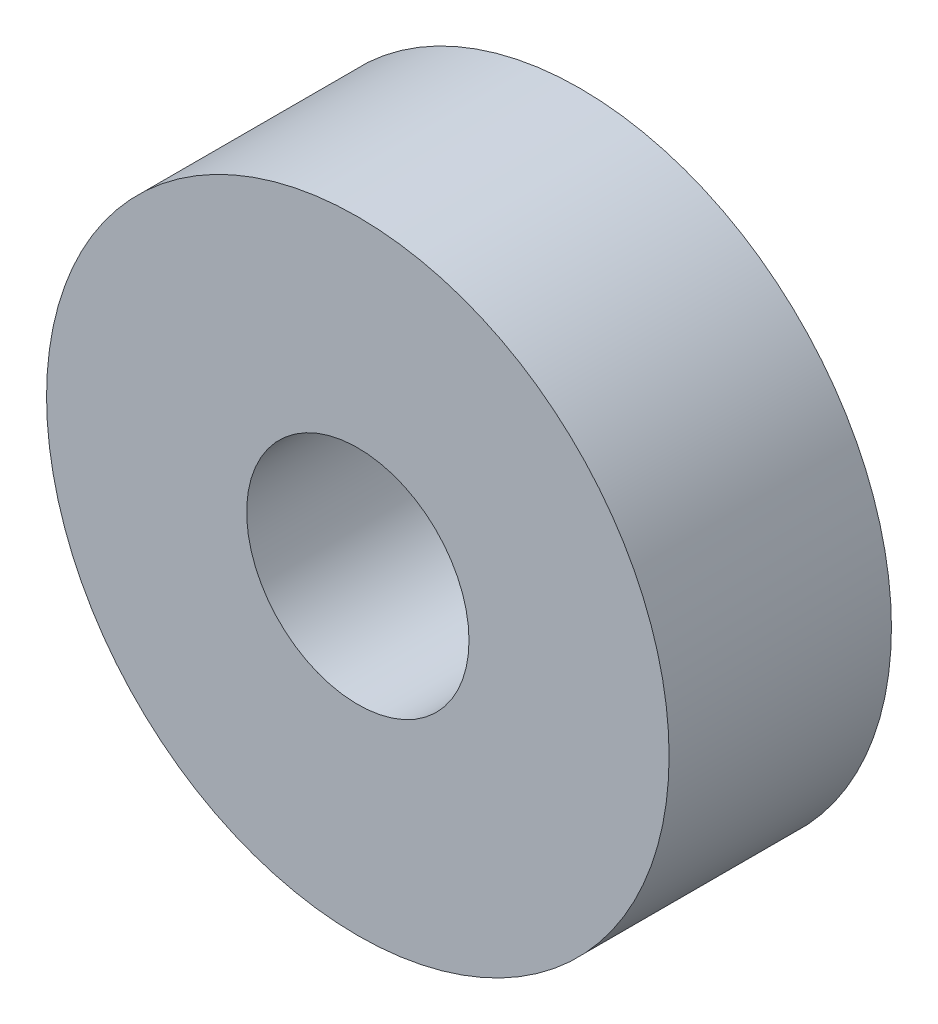
from build123d import *

# Parameters (mm, degrees)
SKETCH1_R           = 7
SKETCH1_R_2         = 2.5
BOSS_EXTRUDE1_DEPTH = 5


with BuildPart() as part:
    # Sketch1 → Boss-Extrude1 (new body)
    with BuildSketch(Plane.XY):
        Circle(SKETCH1_R)
        Circle(SKETCH1_R_2, mode=Mode.SUBTRACT)
    extrude(amount=BOSS_EXTRUDE1_DEPTH)


solid = part.part
